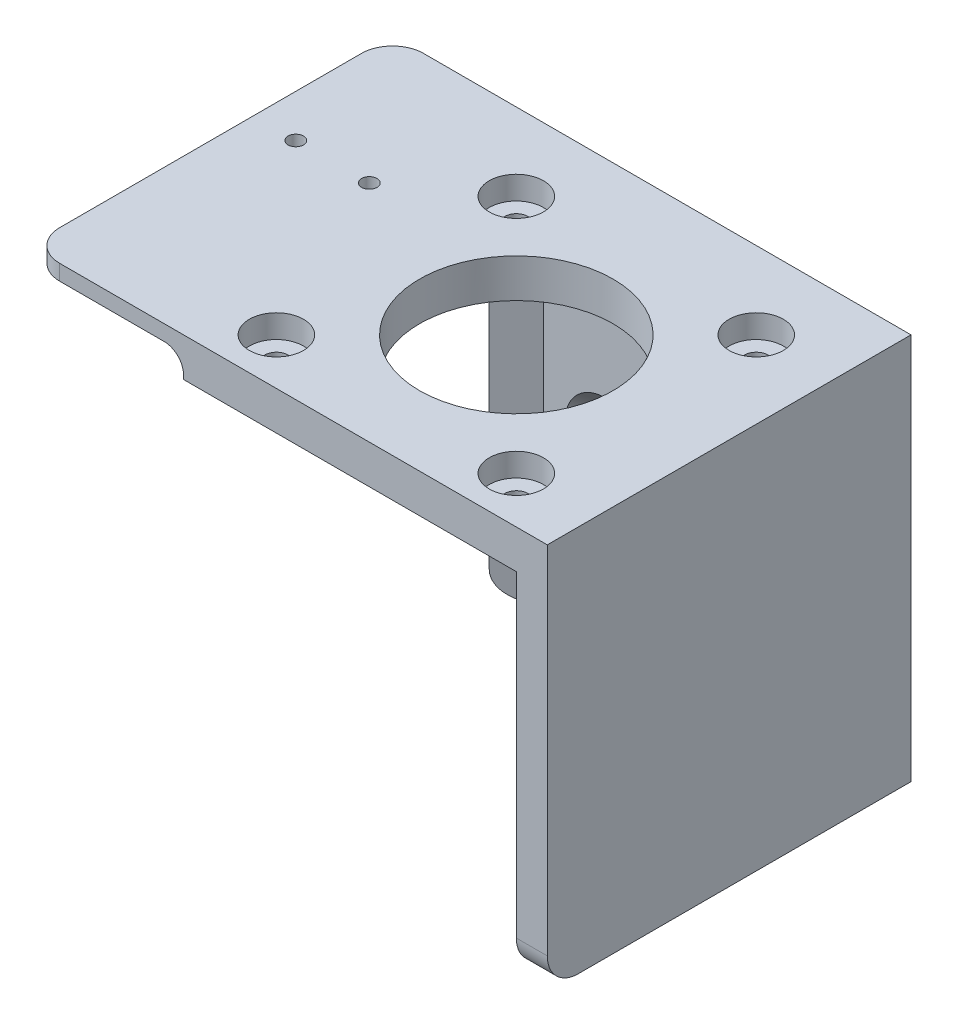
from build123d import *

# Parameters (mm, degrees)
SKETCH_2_W                  = 47
SKETCH_2_H                  = 47
EXTRUDE_1_DEPTH             = 4
SKETCH_3_W                  = 47
SKETCH_3_H                  = 2
EXTRUDE_2_DEPTH             = 43
SKETCH_4_W                  = 4
SKETCH_4_H                  = 45
EXTRUDE_3_DEPTH             = 43
SKETCH_5_R                  = 12.5
CUT_EXTRUDE_1_DEPTH         = 81.268300094
M3X0_5_2_D                  = 3
HOLE_WIZARD_M5_1_AT_2_COUNT = 2
HOLE_WIZARD_M5_1_AT_2_PITCH = 14.142135624
HOLE_WIZARD_M5_1_AT_3_COUNT = 2
HOLE_WIZARD_M5_1_AT_3_PITCH = 20
HOLE_WIZARD_M5_1_AT_4_COUNT = 2
HOLE_WIZARD_M5_1_AT_4_PITCH = 14.142135624
EXTRUDE_6_DEPTH             = 45
EXTRUDE_7_DEPTH             = 45
SKETCH_23_W                 = 67
SKETCH_23_H                 = 47
SKETCH_23_R                 = 3.5
SKETCH_23_R_2               = 12.5
EXTRUDE_10_DEPTH            = 3
M2X0_4_1_D                  = 2
SKETCH_27_W                 = 47
SKETCH_27_H                 = 1
CUT_EXTRUDE_2_DEPTH         = 20
FILLET_1_R                  = 2.5
FILLET_2_R                  = 4


with BuildPart() as part:
    # ｽｹｯﾁ2 → ﾎﾞｽ - 押し出し1 (new body)
    with BuildSketch(Plane.XY):
        with Locations((23.5, 23.5)):
            Rectangle(SKETCH_2_W, SKETCH_2_H)
    extrude(amount=EXTRUDE_1_DEPTH)

    # ｽｹｯﾁ3 → ﾎﾞｽ - 押し出し2 (add)
    with BuildSketch(Plane.XY.offset(4)):
        with Locations((23.5, 46)):
            Rectangle(SKETCH_3_W, SKETCH_3_H)
    extrude(amount=EXTRUDE_2_DEPTH)

    # ｽｹｯﾁ4 → ﾎﾞｽ - 押し出し3 (add)
    with BuildSketch(Plane.XY.offset(4)):
        with Locations((45, 22.5)):
            Rectangle(SKETCH_4_W, SKETCH_4_H)
    extrude(amount=EXTRUDE_3_DEPTH)

    # ｽｹｯﾁ5 → ｶｯﾄ - 押し出し1 (cut, through all)
    with BuildSketch(Plane.XZ.offset(-45)):
        with Locations(Location((21.5, 25.5, 0), (0, 0, 270))):
            Circle(SKETCH_5_R)
    extrude(amount=-CUT_EXTRUDE_1_DEPTH, mode=Mode.SUBTRACT)

    # M3x0.5 ねじ穴2 (through all)
    with Locations(Plane(origin=(0, 47, 0), x_dir=(1, 0, 0), z_dir=(0, 1, 0))):
        with Locations((6, -10), (37, -10), (37, -41), (6, -41)):
            Hole(M3X0_5_2_D / 2)

    # ｽｹｯﾁ14 → M5 平皿頭ねじ用皿穴1 (revolve, cut)
    with BuildSketch(Plane(origin=(11.5, 22, 4), x_dir=(0, -1, 0), z_dir=(1, 0, 0))):
        Polygon((0, 0), (0, 4), (2.75, 4), (2.75, 2.45), (5.2, 0), align=None)
    hole_wizard_m5_1 = revolve(axis=Axis((11.5, 22, 10.35), (0, 0, -1)), mode=Mode.SUBTRACT)

    # M5 平皿頭ねじ用皿穴1 at 2: M5 平皿頭ねじ用皿穴1 ×2
    with Locations(*[Vector(0.7071067811865475, 0.7071067811865476, 0) * (i * HOLE_WIZARD_M5_1_AT_2_PITCH) for i in range(1, HOLE_WIZARD_M5_1_AT_2_COUNT)]):
        add(hole_wizard_m5_1, mode=Mode.SUBTRACT)

    # M5 平皿頭ねじ用皿穴1 at 3: M5 平皿頭ねじ用皿穴1 ×2
    with Locations(*[(i * HOLE_WIZARD_M5_1_AT_3_PITCH, 0, 0) for i in range(1, HOLE_WIZARD_M5_1_AT_3_COUNT)]):
        add(hole_wizard_m5_1, mode=Mode.SUBTRACT)

    # M5 平皿頭ねじ用皿穴1 at 4: M5 平皿頭ねじ用皿穴1 ×2
    with Locations(*[Vector(0.7071067811865474, -0.7071067811865478, 0) * (i * HOLE_WIZARD_M5_1_AT_4_PITCH) for i in range(1, HOLE_WIZARD_M5_1_AT_4_COUNT)]):
        add(hole_wizard_m5_1, mode=Mode.SUBTRACT)

    # ｽｹｯﾁ17 → ﾎﾞｽ - 押し出し6 (add)
    with BuildSketch(Plane.XZ.offset(-45)):
        Polygon((43, 4), (39.5, 4), (43, 7.5), align=None)
    extrude(amount=EXTRUDE_6_DEPTH)

    # ｽｹｯﾁ19 → ﾎﾞｽ - 押し出し7 (add)
    with BuildSketch(Plane.XZ.offset(-45)):
        Polygon((0, 4), (3.5, 4), (0, 7.5), align=None)
    extrude(amount=EXTRUDE_7_DEPTH)

    # ｽｹｯﾁ23 → ﾎﾞｽ - 押し出し10 (add)
    with BuildSketch(Plane(origin=(0, 47, 0), x_dir=(1, 0, 0), z_dir=(0, 1, 0))):
        with Locations((13.5, -23.5)):
            Rectangle(SKETCH_23_W, SKETCH_23_H)
        with Locations(Location((6, -10, 0), (0, 0, 270))):
            Circle(SKETCH_23_R, mode=Mode.SUBTRACT)
        with Locations(Location((6, -41, 0), (0, 0, 270))):
            Circle(SKETCH_23_R, mode=Mode.SUBTRACT)
        with Locations(Location((37, -10, 0), (0, 0, 270))):
            Circle(SKETCH_23_R, mode=Mode.SUBTRACT)
        with Locations(Location((37, -41, 0), (0, 0, 270))):
            Circle(SKETCH_23_R, mode=Mode.SUBTRACT)
        with Locations(Location((21.5, -25.5, 0), (0, 0, 90))):
            Circle(SKETCH_23_R_2, mode=Mode.SUBTRACT)
    extrude(amount=EXTRUDE_10_DEPTH)

    # M2x0.4 ねじ穴1 (through all)
    with Locations(Plane(origin=(0, 50, 0), x_dir=(1, 0, 0), z_dir=(0, 1, 0))):
        with Locations((-5, -18), (-14.5, -18)):
            Hole(M2X0_4_1_D / 2)

    # ｽｹｯﾁ27 → ｶｯﾄ - 押し出し2 (cut)
    with BuildSketch(Plane.ZY.offset(20)):
        with Locations((23.5, 47.5)):
            Rectangle(SKETCH_27_W, SKETCH_27_H)
    extrude(amount=-CUT_EXTRUDE_2_DEPTH, mode=Mode.SUBTRACT)

    # ﾌｨﾚｯﾄ1
    fillet_1_edges = [part.edges().sort_by_distance(p)[0] for p in [
        (0, 48, 23.5),
    ]]
    fillet(fillet_1_edges, radius=FILLET_1_R)

    # ﾌｨﾚｯﾄ2
    fillet_2_edges = [part.edges().sort_by_distance(p)[0] for p in [
        (-20, 49, 47),
        (-20, 49, 0),
        (0, 0, 3.75),
        (45, 0, 47),
    ]]
    fillet(fillet_2_edges, radius=FILLET_2_R)


solid = part.part
